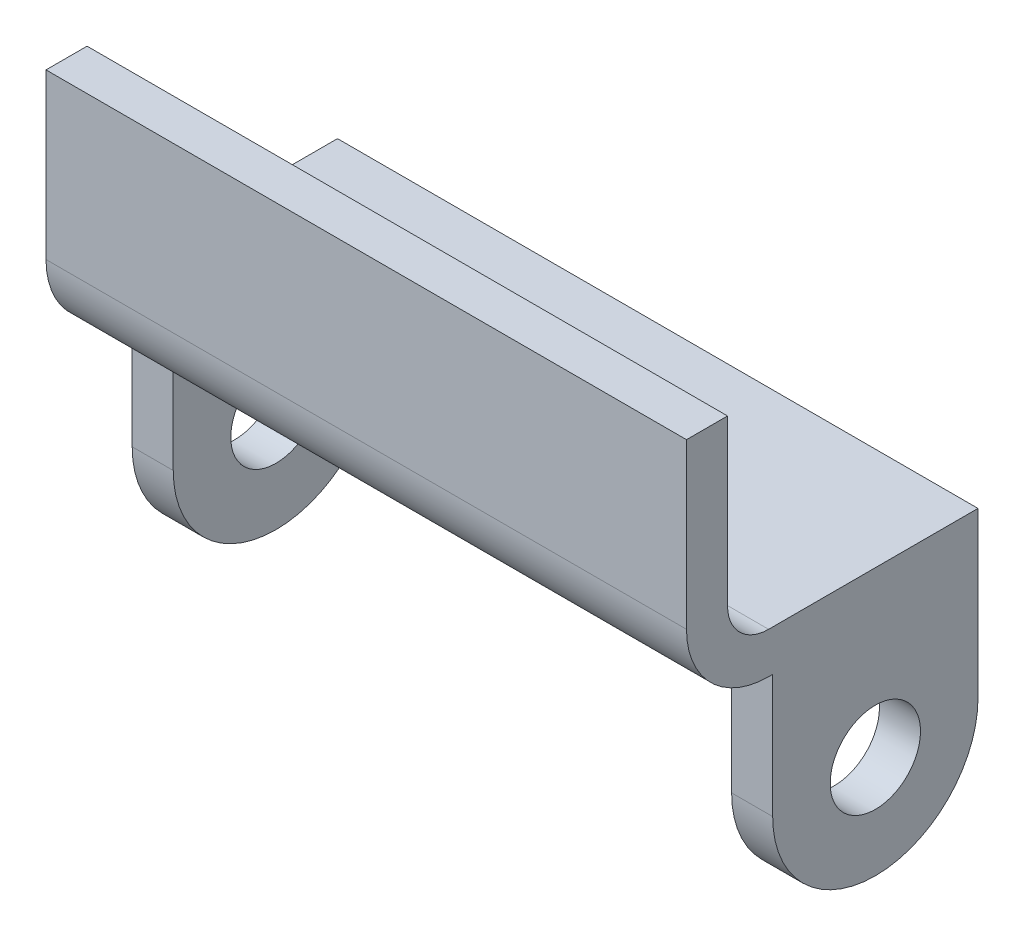
from build123d import *

# Parameters (mm, degrees)
BOSS_EXTRUDE1_DEPTH = 39
SKETCH3_R           = 5.5
BOSS_EXTRUDE2_DEPTH = 5


with BuildPart() as part:
    # Sketch1 → Boss-Extrude1 (new, symmetric)
    with BuildSketch(Plane.YZ):
        with BuildLine():
            Line((-156.635856385, -79.593365073), (-176.635856385, -79.593365073))
            ThreePointArc((-176.635856385, -79.593365073), (-183.706924197, -82.522297262), (-186.635856385, -89.593365073))
            Line((-186.635856385, -89.593365073), (-186.635856385, -115.093365073))
            Line((-186.635856385, -115.093365073), (-181.635856385, -115.093365073))
            Line((-181.635856385, -115.093365073), (-181.635856385, -89.593365073))
            ThreePointArc((-181.635856385, -89.593365073), (-180.171390291, -86.057831168), (-176.635856385, -84.593365073))
            Line((-176.635856385, -84.593365073), (-156.635856385, -84.593365073))
            Line((-156.635856385, -84.593365073), (-156.635856385, -79.593365073))
        make_face()
    extrude(amount=BOSS_EXTRUDE1_DEPTH, both=True)

    # Sketch3 → Boss-Extrude2 (add)
    with BuildSketch(Plane.YZ.offset(39)):
        with BuildLine():
            Line((-181.635856385, -115.093365073), (-201.635856385, -115.093365073))
            ThreePointArc((-201.635856385, -115.093365073), (-214.13814738, -102.591074078), (-201.635856385, -90.088783083))
            Line((-201.635856385, -90.088783083), (-181.635856385, -90.088783083))
            Line((-181.635856385, -90.088783083), (-181.635856385, -115.093365073))
        make_face()
        with Locations(Location((-201.635856385, -102.591074078, 0), (0, 0, 270))):
            Circle(SKETCH3_R, mode=Mode.SUBTRACT)
    boss_extrude2 = extrude(amount=-BOSS_EXTRUDE2_DEPTH)

    # Mirror1: Boss-Extrude2 across plane
    add(boss_extrude2.mirror(Plane(origin=(0, 0, 0), x_dir=(0, 0, 1), z_dir=(1, 0, 0))))


solid = part.part
